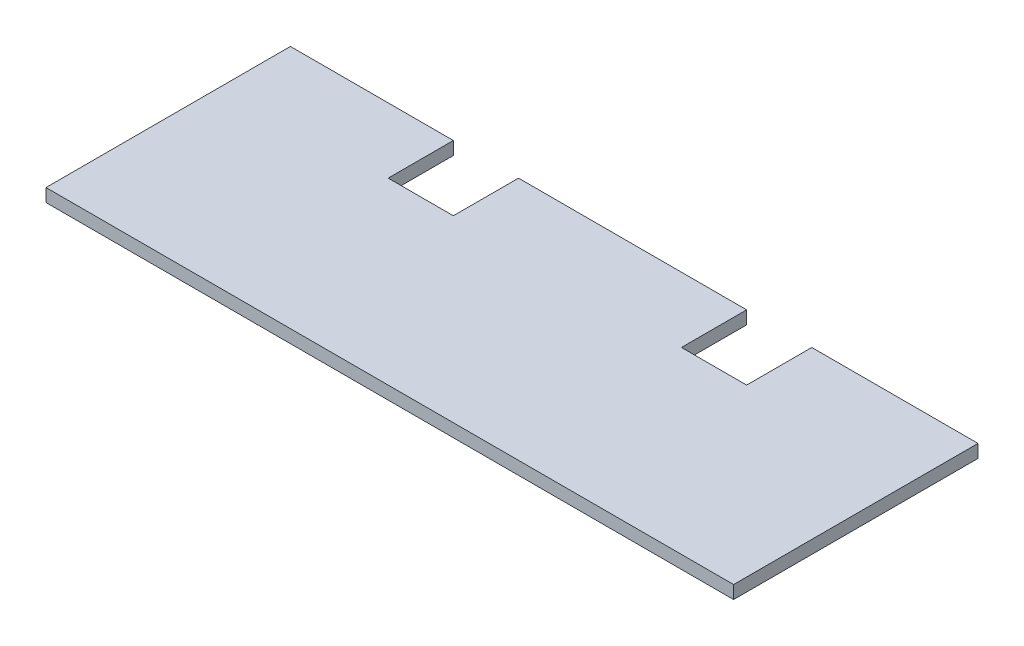
from build123d import *

# Parameters (mm, degrees)
SKETCH1_W           = 211
SKETCH1_H           = 75
BOSS_EXTRUDE1_DEPTH = 4
CUT_EXTRUDE2_REACH  = 114.038
CUT_EXTRUDE3_REACH  = 114.038


with BuildPart() as part:
    # Sketch1 → Boss-Extrude1 (new body)
    with BuildSketch(Plane(origin=(0, 0, 0), x_dir=(1, 0, 0), z_dir=(0, 1, 0))):
        Rectangle(SKETCH1_W, SKETCH1_H)
    extrude(amount=BOSS_EXTRUDE1_DEPTH)

    # Sketch3 → Cut-Extrude2 (cut, up to next)
    with BuildSketch(Plane(origin=(0, 4, 0), x_dir=(1, 0, 0), z_dir=(0, 1, 0)), mode=Mode.PRIVATE) as cut_extrude2_sk1:
        Polygon((-55.5, 37.5), (-55.5, 17.5), (-35.5, 17.5), (-35.5, 21.173298158), (-35.5, 37.5), align=None)
    cut_extrude2_tool1 = extrude(cut_extrude2_sk1.sketch, amount=-CUT_EXTRUDE2_REACH, mode=Mode.PRIVATE) & part.part
    add(cut_extrude2_tool1.solids().sort_by_distance((-45.5, 4, -27.5))[0], mode=Mode.SUBTRACT)

    # Sketch5 → Cut-Extrude3 (cut, up to next)
    with BuildSketch(Plane(origin=(0, 4, 0), x_dir=(1, 0, 0), z_dir=(0, 1, 0)), mode=Mode.PRIVATE) as cut_extrude3_sk1:
        Polygon((44.5, 17.5), (54.5, 17.5), (54.5, 37.5), (34.5, 37.5), (34.5, 17.5), align=None)
    cut_extrude3_tool1 = extrude(cut_extrude3_sk1.sketch, amount=-CUT_EXTRUDE3_REACH, mode=Mode.PRIVATE) & part.part
    add(cut_extrude3_tool1.solids().sort_by_distance((44.5, 4, -27.5))[0], mode=Mode.SUBTRACT)


solid = part.part
